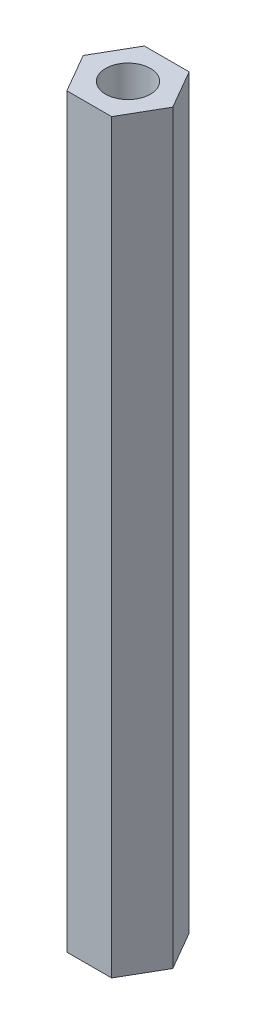
from build123d import *

# Parameters (mm, degrees)
SKETCH1_R           = 1.5
BOSS_EXTRUDE1_DEPTH = 50


with BuildPart() as part:
    # Sketch1 → Boss-Extrude1 (new body)
    with BuildSketch(Plane(origin=(0, 0, 0), x_dir=(1, 0, 0), z_dir=(0, 1, 0))):
        Polygon((3, 0), (1.5, 2.598076211), (-1.5, 2.598076211), (-3, 0), (-1.5, -2.598076211), (1.5, -2.598076211), align=None)
        with Locations(Location((0, 0, 0), (0, 0, 270))):
            Circle(SKETCH1_R, mode=Mode.SUBTRACT)
    extrude(amount=BOSS_EXTRUDE1_DEPTH)


solid = part.part
